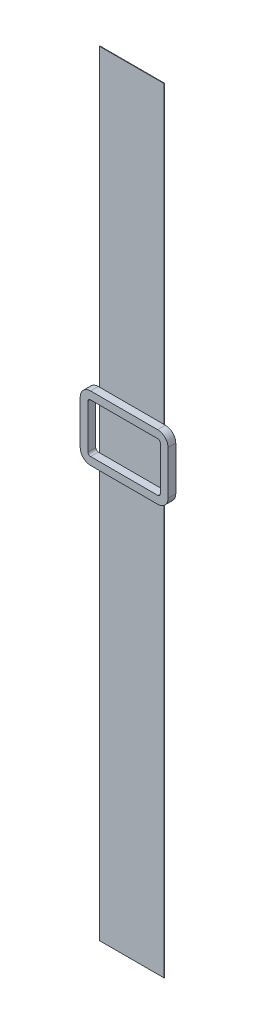
from build123d import *

# Parameters (mm, degrees)
ESQUISSE1_W      = 25
ESQUISSE1_H      = 300
EXTRUSION1_DEPTH = 0.2
EXTRUSION2_DEPTH = 3


with BuildPart() as part:
    # Esquisse1 → Extrusion1 (new body)
    with BuildSketch(Plane.XY):
        with Locations((12.5, 150)):
            Rectangle(ESQUISSE1_W, ESQUISSE1_H)
    extrude(amount=EXTRUSION1_DEPTH)

    # Esquisse2 → Extrusion2 (add)
    with BuildSketch(Plane.XY.offset(0.2)):
        with BuildLine():
            Line((-0.5, 185.652949425), (25.5, 185.652949425))
            ThreePointArc((25.5, 185.652949425), (28.328427125, 184.48137655), (29.5, 181.652949425))
            Line((29.5, 181.652949425), (29.5, 164.652949425))
            ThreePointArc((29.5, 164.652949425), (28.328427125, 161.8245223), (25.5, 160.652949425))
            Line((25.5, 160.652949425), (-0.5, 160.652949425))
            ThreePointArc((-0.5, 160.652949425), (-3.328427125, 161.8245223), (-4.5, 164.652949425))
            Line((-4.5, 164.652949425), (-4.5, 181.652949425))
            ThreePointArc((-4.5, 181.652949425), (-3.328427125, 184.48137655), (-0.5, 185.652949425))
        make_face()
        with BuildLine():
            Line((-0.5, 182.652949425), (25.5, 182.652949425))
            ThreePointArc((25.5, 182.652949425), (26.207106781, 182.360056206), (26.5, 181.652949425))
            Line((26.5, 181.652949425), (26.5, 164.652949425))
            ThreePointArc((26.5, 164.652949425), (26.207106781, 163.945842644), (25.5, 163.652949425))
            Line((25.5, 163.652949425), (-0.5, 163.652949425))
            ThreePointArc((-0.5, 163.652949425), (-1.207106781, 163.945842644), (-1.5, 164.652949425))
            Line((-1.5, 164.652949425), (-1.5, 181.652949425))
            ThreePointArc((-1.5, 181.652949425), (-1.207106781, 182.360056206), (-0.5, 182.652949425))
        make_face(mode=Mode.SUBTRACT)
    extrude(amount=EXTRUSION2_DEPTH)


solid = part.part
